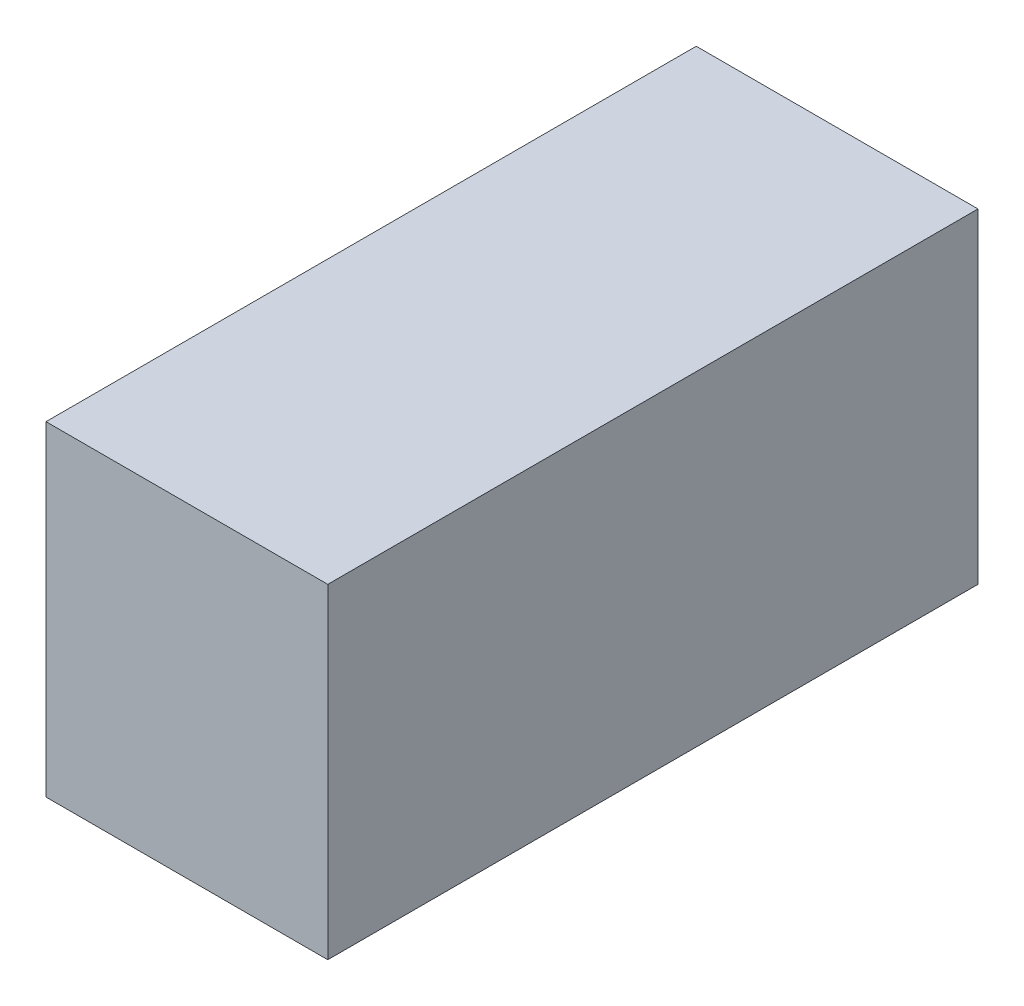
from build123d import *

# Parameters (mm, degrees)
SKETCH1_W           = 13
SKETCH1_H           = 30
BOSS_EXTRUDE1_DEPTH = 15


with BuildPart() as part:
    # Sketch1 → Boss-Extrude1 (new body)
    with BuildSketch(Plane(origin=(0, 0, 0), x_dir=(1, 0, 0), z_dir=(0, 1, 0))):
        with Locations((-3.178178939, -5.942445989)):
            Rectangle(SKETCH1_W, SKETCH1_H)
    extrude(amount=BOSS_EXTRUDE1_DEPTH)


solid = part.part
